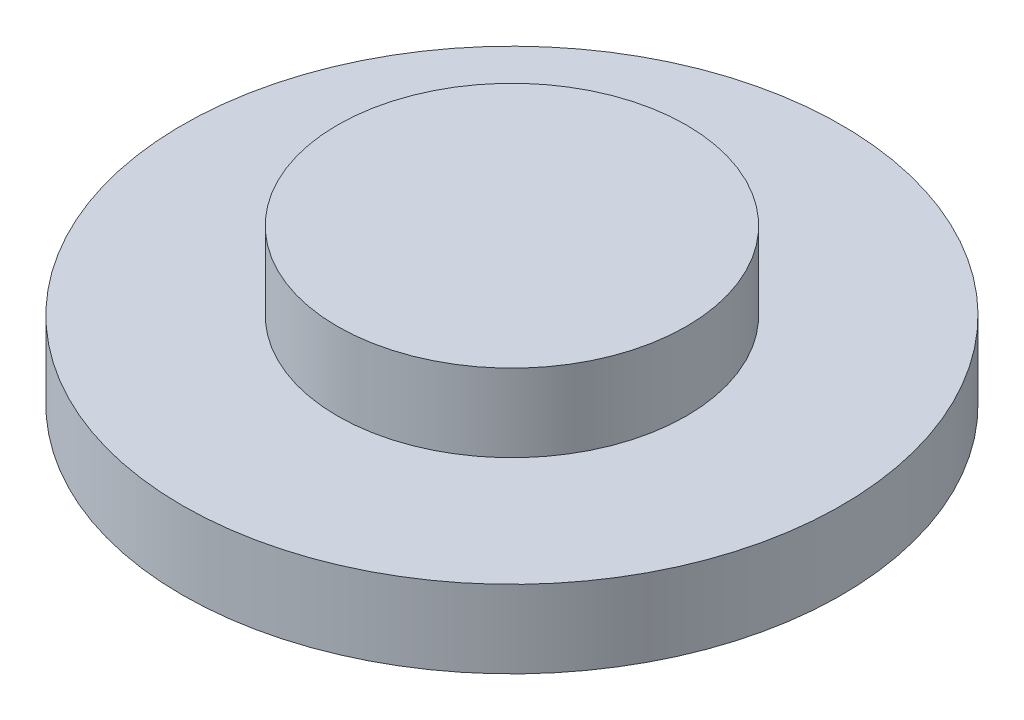
from build123d import *

# Parameters (mm, degrees)
SKETCH1_R           = 8.5
BOSS_EXTRUDE2_DEPTH = 2
SKETCH2_R           = 4.5
BOSS_EXTRUDE3_DEPTH = 2
SKETCH4_R           = 4.75
CUT_EXTRUDE1_DEPTH  = 1


with BuildPart() as part:
    # Sketch1 → Boss-Extrude2 (new body)
    with BuildSketch(Plane(origin=(0, 0, 0), x_dir=(1, 0, 0), z_dir=(0, 1, 0))):
        with Locations(Location((0, 0, 0), (0, 0, 270))):
            Circle(SKETCH1_R)
    extrude(amount=BOSS_EXTRUDE2_DEPTH)

    # Sketch2 → Boss-Extrude3 (add)
    with BuildSketch(Plane(origin=(0, 2, 0), x_dir=(1, 0, 0), z_dir=(0, 1, 0))):
        with Locations(Location((0, 0, 0), (0, 0, 270))):
            Circle(SKETCH2_R)
    extrude(amount=BOSS_EXTRUDE3_DEPTH)

    # Sketch4 → Cut-Extrude1 (cut)
    with BuildSketch(Plane.XZ):
        with Locations(Location((0, 0, 0), (0, 0, 270))):
            Circle(SKETCH4_R)
    extrude(amount=-CUT_EXTRUDE1_DEPTH, mode=Mode.SUBTRACT)


solid = part.part
